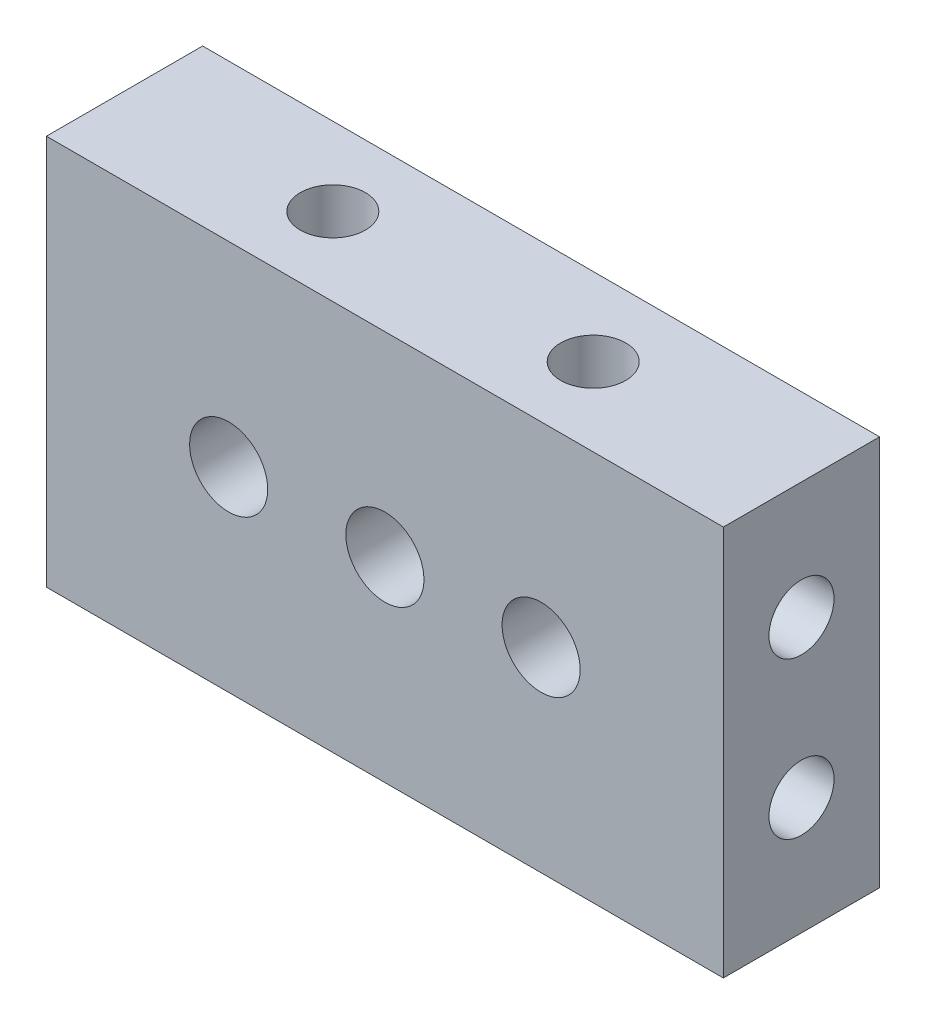
from build123d import *

# Parameters (mm, degrees)
SKETCH_1_W                  = 26
SKETCH_1_H                  = 15
EXTRUDE_1_DEPTH             = 5
SKETCH_2_W                  = 26
SKETCH_2_H                  = 15
EXTRUDE_2_DEPTH             = 1
HOLE_WIZARD_M3_1_AT_2_COUNT = 2
HOLE_WIZARD_M3_1_AT_2_PITCH = 6
SKETCH_5_R                  = 1.5
CUT_EXTRUDE_1_DEPTH         = 7
HOLE_WIZARD_M3_2_D          = 2.5
HOLE_WIZARD_M3_2_DEPTH      = 7
HOLE_WIZARD_M3_2_TIP        = 0.751075774


with BuildPart() as part:
    # 草图1 → 凸台-拉伸1 (new body)
    with BuildSketch(Plane.XY):
        Rectangle(SKETCH_1_W, SKETCH_1_H)
    extrude(amount=EXTRUDE_1_DEPTH)

    # 草图2 → 凸台-拉伸2 (add)
    with BuildSketch(Plane.XY.offset(5)):
        Rectangle(SKETCH_2_W, SKETCH_2_H)
    extrude(amount=EXTRUDE_2_DEPTH)

    # 草图4 → M3 螺纹孔1 (revolve, cut)
    with BuildSketch(Plane(origin=(-13, -3, 3), x_dir=(0, 0, 1), z_dir=(0, 1, 0))):
        Polygon((0, 0), (0, 5.751075774), (1.25, 5), (1.25, 0), align=None)
    hole_wizard_m3_1 = revolve(axis=Axis((-19.35, -3, 3), (1, 0, 0)), mode=Mode.SUBTRACT)

    # M3 螺纹孔1 at 2: M3 螺纹孔1 ×2
    with Locations(*[(0, i * HOLE_WIZARD_M3_1_AT_2_PITCH, 0) for i in range(1, HOLE_WIZARD_M3_1_AT_2_COUNT)]):
        add(hole_wizard_m3_1, mode=Mode.SUBTRACT)

    # 镜向1: M3 螺纹孔1 across plane
    add(hole_wizard_m3_1.mirror(Plane(origin=(0, 0, 0), x_dir=(0, 0, 1), z_dir=(1, 0, 0))), mode=Mode.SUBTRACT)

    # 镜向1 copy 1 sketch → 镜向1 copy 1 (revolve, cut)
    with BuildSketch(Plane(origin=(13, 3, 3), x_dir=(0, 0, 1), z_dir=(0, 1, 0))):
        Polygon((0, 0), (0, -5.751075774), (1.25, -5), (1.25, 0), align=None)
    revolve(axis=Axis((19.35, 3, 3), (1, 0, 0)), mode=Mode.SUBTRACT)

    # 草图5 → 切除-拉伸1 (cut)
    with BuildSketch(Plane(origin=(0, 0, 0), x_dir=(-1, 0, 0), z_dir=(0, 0, -1))):
        with Locations((6, 0)):
            Circle(SKETCH_5_R)
        Circle(SKETCH_5_R)
        with Locations((-6, 0)):
            Circle(SKETCH_5_R)
    extrude(amount=-CUT_EXTRUDE_1_DEPTH, mode=Mode.SUBTRACT)

    # M3 螺纹孔2
    with Locations(Plane(origin=(5, 7.5, 3), x_dir=(0, 0, 1), z_dir=(0, 1, 0))):
        with Locations((0, 0), (0, -10)):
            Hole(HOLE_WIZARD_M3_2_D / 2, depth=HOLE_WIZARD_M3_2_DEPTH)
            with Locations((0, 0, -(HOLE_WIZARD_M3_2_DEPTH + HOLE_WIZARD_M3_2_TIP / 2))):  # 118° drill point
                Cone(0, HOLE_WIZARD_M3_2_D / 2, HOLE_WIZARD_M3_2_TIP, mode=Mode.SUBTRACT)


solid = part.part
